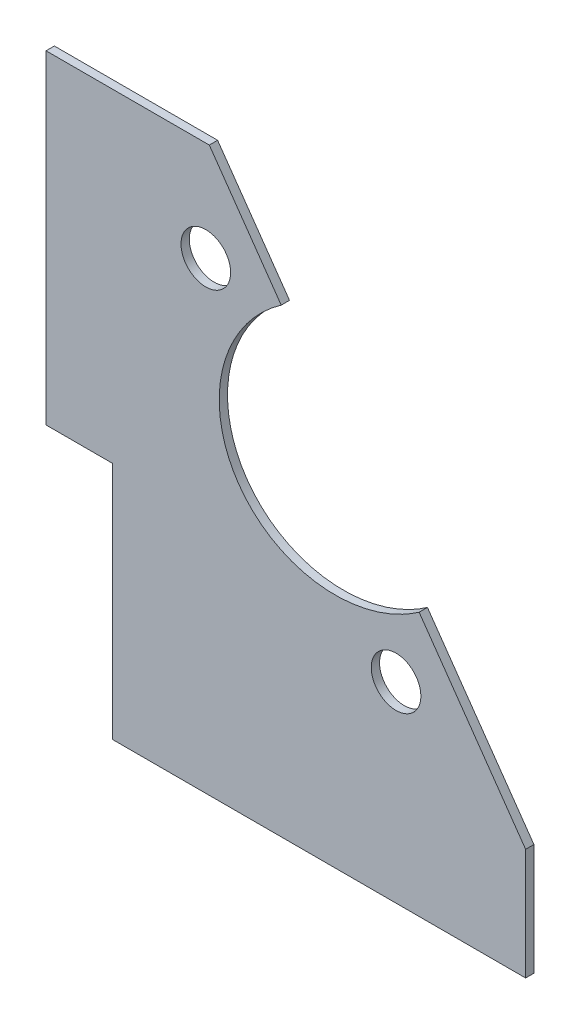
from build123d import *

# Parameters (mm, degrees)
BOSS_EXTRUDE1_DEPTH = 1.5875
SKETCH2_R           = 4.75
CUT_EXTRUDE1_DEPTH  = 135.08080599
CUT_EXTRUDE2_DEPTH  = 135.08080599
SKETCH4_W           = 1.5875
SKETCH4_H           = 62
BOSS_EXTRUDE2_DEPTH = 12.75
SKETCH5_W           = 79
SKETCH5_H           = 1.5875
BOSS_EXTRUDE3_DEPTH = 12.75


with BuildPart() as part:
    # Sketch1 → Boss-Extrude1 (new body)
    with BuildSketch(Plane.XY):
        with BuildLine():
            add(Edge.make_bspline(
                [(32.238440812, 75.351315587), (10.94048766, 60.438328242), (24.132745696, 41.597831224), (37.325003732, 22.757334205), (58.622956884, 37.67032155)],
                knots=[1.570796327, 1.570796327, 1.570796327, 3.141592654, 3.141592654, 4.71238898, 4.71238898, 4.71238898], degree=2, weights=[1, 0.707106781, 1, 0.707106781, 1]))
            Line((58.622956884, 37.67032155), (85, 0))
            Line((85, 0), (0, 0))
            Line((0, 0), (0, 95))
            Line((0, 95), (12.400456604, 103.682893191))
            Line((12.400456604, 103.682893191), (32.238440812, 75.351315587))
        make_face()
    extrude(amount=BOSS_EXTRUDE1_DEPTH)

    # Sketch2 → Cut-Extrude1 (cut, through all)
    with BuildSketch(Plane.XY.offset(1.5875)):
        with Locations((17.813737895, 75.902288156)):
            Circle(SKETCH2_R)
        with Locations((54.207162782, 23.927090946)):
            Circle(SKETCH2_R)
    extrude(amount=-CUT_EXTRUDE1_DEPTH, mode=Mode.SUBTRACT)

    # Sketch3 → Cut-Extrude2 (cut, through all)
    with BuildSketch(Plane.XY.offset(1.5875)):
        Polygon((79, 8.56888804), (79, 0), (85, 0), align=None)
        Polygon((0, 95), (18.48028387, 95), (12.400456604, 103.682893191), align=None)
    extrude(amount=-CUT_EXTRUDE2_DEPTH, mode=Mode.SUBTRACT)

    # Sketch4 → Boss-Extrude2 (add)
    with BuildSketch(Plane.ZY):
        with Locations((0.79375, 64)):
            Rectangle(SKETCH4_W, SKETCH4_H)
    extrude(amount=BOSS_EXTRUDE2_DEPTH)

    # Sketch5 → Boss-Extrude3 (add)
    with BuildSketch(Plane.XZ):
        with Locations((39.5, 0.79375)):
            Rectangle(SKETCH5_W, SKETCH5_H)
    extrude(amount=BOSS_EXTRUDE3_DEPTH)


solid = part.part
